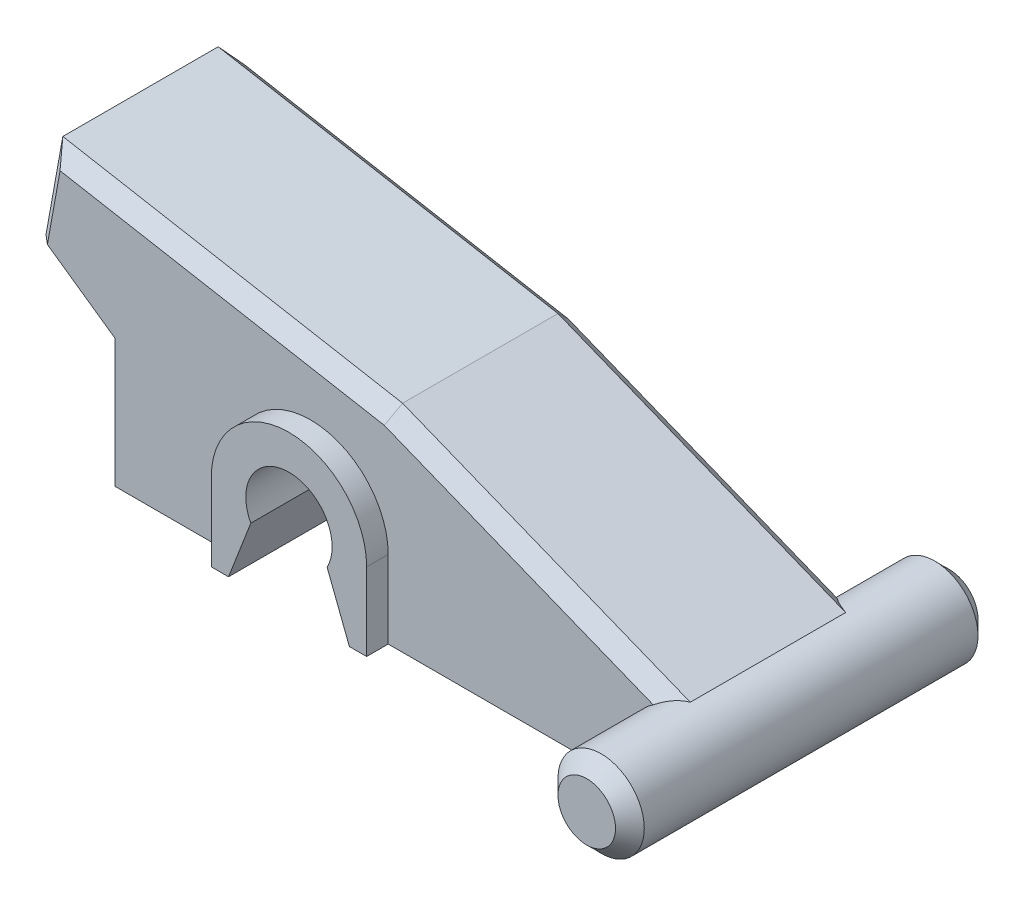
from build123d import *

# Parameters (mm, degrees)
BOSS_EXTRUDE1_DEPTH     = 3.2
BOSS_EXTRUDE2_DEPTH     = 0.75
CUT_EXTRUDE1_DEPTH      = 16.439388307
CUT_EXTRUDE1_DEPTH_BACK = 16.439388307
SKETCH4_R               = 1.5
BOSS_EXTRUDE3_DEPTH     = 6.3
CHAMFER1_SIZE           = 0.5
CHAMFER2_SIZE           = 0.5
CUT_EXTRUDE2_DEPTH      = 5.2


with BuildPart() as part:
    # Sketch1 → Boss-Extrude1 (new, symmetric)
    with BuildSketch(Plane.XY):
        Polygon((-10, -4.4), (10, -4.4), (10, -1.4), (0, 2.6), (-10, 4.4), (-10, -0.2), align=None)
        Polygon((-12.394804782, 1.478031011), (-10, -0.2), (-10, 4.4), (-11.810199888, 4.72583598), align=None)
    extrude(amount=BOSS_EXTRUDE1_DEPTH, both=True)

    # Sketch2 → Boss-Extrude2 (add, symmetric)
    with BuildSketch(Plane.XY.offset(3.2)):
        with BuildLine():
            ThreePointArc((0, -1.7), (-2.7, 1), (-5.4, -1.7))
            Line((-5.4, -1.7), (-2.7, -4.4))
            Line((-2.7, -4.4), (0, -1.7))
        make_face()
        with BuildLine():
            Line((-2.7, -4.4), (-5.4, -1.7))
            ThreePointArc((-5.4, -1.7), (-4.609188309, -3.609188309), (-2.7, -4.4))
        make_face()
        with BuildLine():
            Line((0, -1.7), (-2.7, -4.4))
            ThreePointArc((-2.7, -4.4), (-0.790811691, -3.609188309), (0, -1.7))
        make_face()
        with BuildLine():
            ThreePointArc((0, -1.7), (-0.790811691, -3.609188309), (-2.7, -4.4))
            Line((-2.7, -4.4), (0, -4.4))
            Line((0, -4.4), (0, -1.7))
        make_face()
        with BuildLine():
            ThreePointArc((-2.7, -4.4), (-4.609188309, -3.609188309), (-5.4, -1.7))
            Line((-5.4, -1.7), (-5.4, -4.4))
            Line((-5.4, -4.4), (-2.7, -4.4))
        make_face()
    boss_extrude2 = extrude(amount=BOSS_EXTRUDE2_DEPTH, both=True)

    # Mirror1: Boss-Extrude2 across plane
    add(boss_extrude2.mirror(Plane.XY))

    # Sketch3 → Cut-Extrude1 (cut, two sides: drawn at the far end of the back side and taken through both)
    with BuildSketch(Plane.XY.offset(3.95).offset(-CUT_EXTRUDE1_DEPTH_BACK)):
        with BuildLine():
            ThreePointArc((-1.2, -1.7), (-3.060572549, -0.243982336), (-4.026649916, -2.4))
            Line((-4.026649916, -2.4), (-1.373350084, -2.4))
            ThreePointArc((-1.373350084, -2.4), (-1.243982336, -2.060572549), (-1.2, -1.7))
        make_face()
        with BuildLine():
            Line((-1.373350084, -2.4), (-4.026649916, -2.4))
            ThreePointArc((-4.026649916, -2.4), (-2.7, -3.2), (-1.373350084, -2.4))
        make_face()
        with BuildLine():
            Line((-4.026649916, -2.4), (-4.8, -4.4))
            Line((-4.8, -4.4), (-0.6, -4.4))
            Line((-0.6, -4.4), (-1.373350084, -2.4))
            ThreePointArc((-1.373350084, -2.4), (-2.7, -3.2), (-4.026649916, -2.4))
        make_face()
    extrude(amount=CUT_EXTRUDE1_DEPTH + CUT_EXTRUDE1_DEPTH_BACK, mode=Mode.SUBTRACT)

    # Sketch4 → Boss-Extrude3 (add, symmetric)
    with BuildSketch(Plane.XY):
        with Locations((10, -2.9)):
            Circle(SKETCH4_R)
    extrude(amount=BOSS_EXTRUDE3_DEPTH, both=True)

    # Chamfer1
    chamfer1_edges = [part.edges().sort_by_distance(p)[0] for p in [
        (8.5, -2.9, -6.3),
        (8.5, -2.9, 6.3),
    ]]
    chamfer(chamfer1_edges, length=CHAMFER1_SIZE)

    # Chamfer2
    chamfer2_edges = [part.edges().sort_by_distance(p)[0] for p in [
        (-5.905099944, 3.66291799, 3.2),
        (-11.197402391, 0.639015505, -3.2),
        (-12.102502335, 3.101933495, -3.2),
        (-5.905099944, 3.66291799, -3.2),
        (5, 0.6, -3.2),
        (-12.102502335, 3.101933495, 3.2),
        (-11.197402391, 0.639015505, 3.2),
        (-10, -2.3, 3.2),
        (5, 0.6, 3.2),
        (-10, -2.3, -3.2),
    ]]
    chamfer(chamfer2_edges, length=CHAMFER2_SIZE)

    # Sketch5 → Cut-Extrude2 (cut)
    with BuildSketch(Plane.XY.offset(3.2)):
        with BuildLine():
            Line((-10.438248334, 2.751564232), (-10.529148071, 2.246565691))
            Line((-10.529148071, 2.246565691), (-8.3, 0.684609736))
            Line((-8.3, 0.684609736), (-8.3, -3.2))
            Line((-8.3, -3.2), (-5.4, -3.2))
            Line((-5.4, -3.2), (-5.4, -1.7))
            ThreePointArc((-5.4, -1.7), (-2.7, 1), (0, -1.7))
            Line((0, -1.7), (0, -3.2))
            Line((0, -3.2), (7.316718427, -3.2))
            ThreePointArc((7.316718427, -3.2), (7.308115775, -2.690812714), (7.395278362, -2.189067379))
            Line((7.395278362, -2.189067379), (-0.471070755, 0.957472268))
            Line((-0.471070755, 0.957472268), (-10.438248334, 2.751564232))
        make_face()
    extrude(amount=-CUT_EXTRUDE2_DEPTH, mode=Mode.SUBTRACT)


with BuildPart() as body_2:
    # Mirror2: mirrored copy
    add(part.part.mirror(Plane.XY.offset(3.2)))


solid = body_2.part
